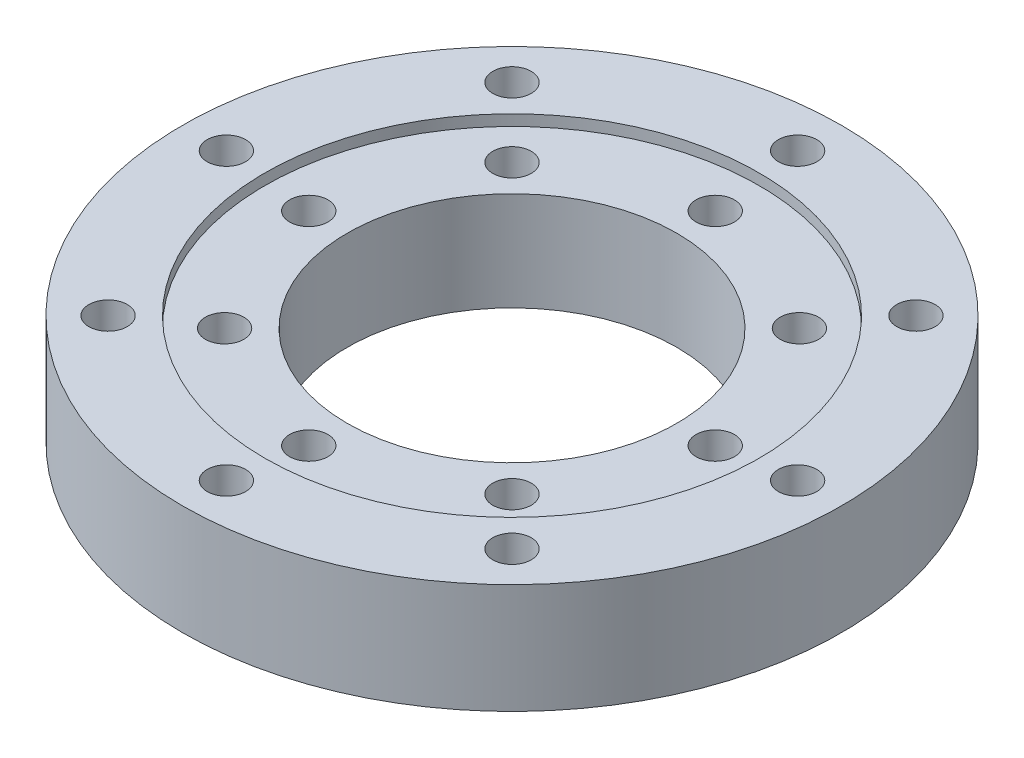
from build123d import *

# Parameters (mm, degrees)
SKETCH1_R           = 30
BOSS_EXTRUDE1_DEPTH = 10
SKETCH2_R           = 15
CUT_EXTRUDE1_DEPTH  = 44.588989435
SKETCH3_R           = 22.5
CUT_EXTRUDE2_DEPTH  = 1
SKETCH4_R           = 1.75
CUT_EXTRUDE3_DEPTH  = 44.370496884
CIRPATTERN1_COUNT   = 8
SKETCH5_R           = 1.75
CUT_EXTRUDE4_DEPTH  = 44.588989435
CIRPATTERN2_COUNT   = 8


with BuildPart() as part:
    # Sketch1 → Boss-Extrude1 (new body)
    with BuildSketch(Plane(origin=(0, 0, 0), x_dir=(1, 0, 0), z_dir=(0, 1, 0))):
        with Locations(Location((0, 0, 0), (0, 0, 270))):
            Circle(SKETCH1_R)
    extrude(amount=BOSS_EXTRUDE1_DEPTH)

    # Sketch2 → Cut-Extrude1 (cut, through all)
    with BuildSketch(Plane(origin=(0, 10, 0), x_dir=(1, 0, 0), z_dir=(0, 1, 0))):
        with Locations(Location((0, 0, 0), (0, 0, 270))):
            Circle(SKETCH2_R)
    extrude(amount=-CUT_EXTRUDE1_DEPTH, mode=Mode.SUBTRACT)

    # Sketch3 → Cut-Extrude2 (cut)
    with BuildSketch(Plane(origin=(0, 10, 0), x_dir=(1, 0, 0), z_dir=(0, 1, 0))):
        with Locations(Location((0, 0, 0), (0, 0, 270))):
            Circle(SKETCH3_R)
    extrude(amount=-CUT_EXTRUDE2_DEPTH, mode=Mode.SUBTRACT)

    # Sketch4 → Cut-Extrude3 (cut, through all)
    with BuildSketch(Plane(origin=(0, 9, 0), x_dir=(1, 0, 0), z_dir=(0, 1, 0))):
        with Locations(Location((0, 18.5, 0), (0, 0, 270))):
            Circle(SKETCH4_R)
    cut_extrude3 = extrude(amount=-CUT_EXTRUDE3_DEPTH, mode=Mode.SUBTRACT)

    # CirPattern1: Cut-Extrude3 ×8 about axis
    cirpattern1_axis = Axis((0, 0, 0), (0, 1, 0))
    for i in range(1, CIRPATTERN1_COUNT):
        add(cut_extrude3.rotate(cirpattern1_axis, i * 360 / CIRPATTERN1_COUNT), mode=Mode.SUBTRACT)

    # Sketch5 → Cut-Extrude4 (cut, through all)
    with BuildSketch(Plane(origin=(0, 10, 0), x_dir=(1, 0, 0), z_dir=(0, 1, 0))):
        with Locations(Location((0, 26, 0), (0, 0, 270))):
            Circle(SKETCH5_R)
    cut_extrude4 = extrude(amount=-CUT_EXTRUDE4_DEPTH, mode=Mode.SUBTRACT)

    # CirPattern2: Cut-Extrude4 ×8 about axis
    cirpattern2_axis = Axis((0, 0, 0), (0, 1, 0))
    for i in range(1, CIRPATTERN2_COUNT):
        add(cut_extrude4.rotate(cirpattern2_axis, i * 360 / CIRPATTERN2_COUNT), mode=Mode.SUBTRACT)


solid = part.part
